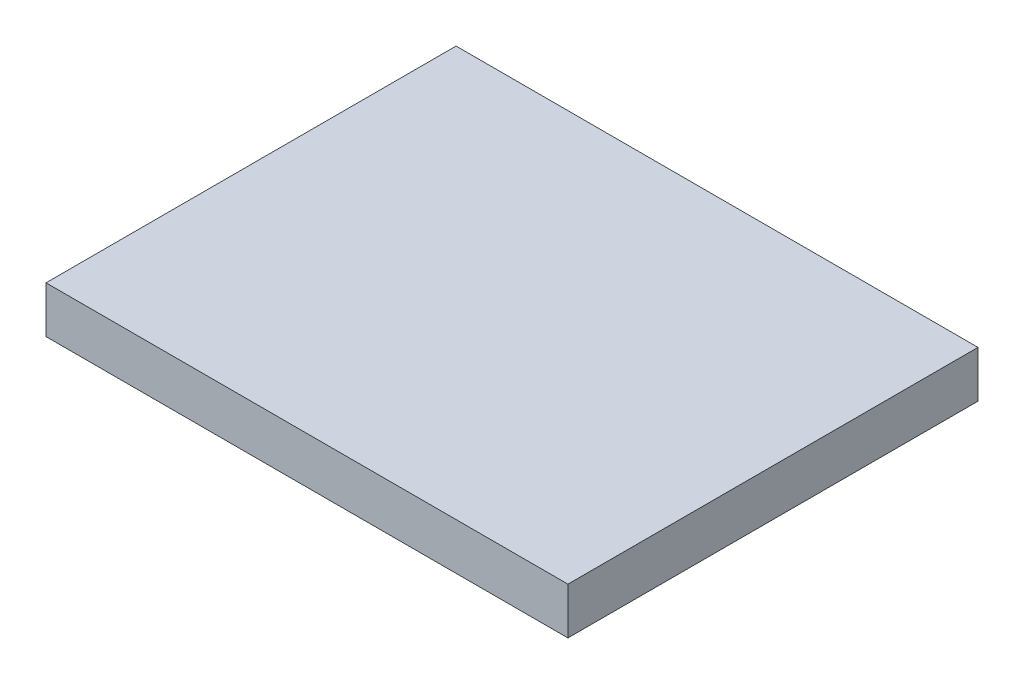
from build123d import *

# Parameters (mm, degrees)
SKETCH1_W           = 17.78
SKETCH1_H           = 13.97
BOSS_EXTRUDE1_DEPTH = 1.5875


with BuildPart() as part:
    # Sketch1 → Boss-Extrude1 (new body)
    with BuildSketch(Plane(origin=(0, 0, 0), x_dir=(1, 0, 0), z_dir=(0, 1, 0))):
        with Locations((8.89, 6.985)):
            Rectangle(SKETCH1_W, SKETCH1_H)
    extrude(amount=BOSS_EXTRUDE1_DEPTH)


solid = part.part
